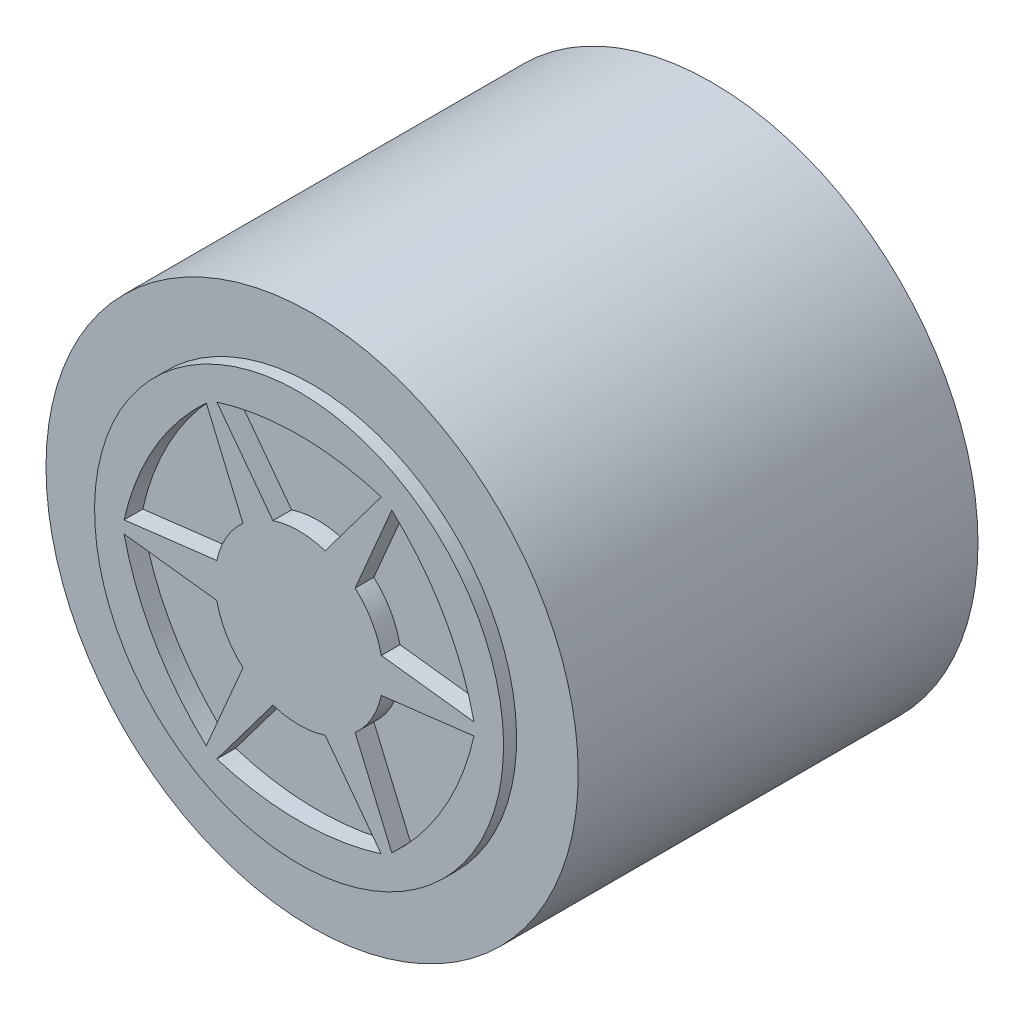
from build123d import *

# Parameters (mm, degrees)
CORTAR_EXTRUIR4_DEPTH      = 1
CROQUIS7_R                 = 7.5
CORTAR_EXTRUIR5_DEPTH      = 9
CORTAR_EXTRUIR6_DEPTH      = 9
CORTAR_EXTRUIR8_DEPTH      = 5
CORTAR_EXTRUIR8_DEPTH_BACK = 28.93644573
CROQUIS10_R                = 3
CROQUIS11_R                = 1.5
CORTAR_EXTRUIR9_DEPTH      = 5.2


with BuildPart() as part:
    # Croquis1 → Revolución1 (revolve)
    with BuildSketch(Plane(origin=(0, 0, 0), x_dir=(0, 0, -1), z_dir=(1, 0, 0))):
        Polygon((0, 0), (9.25, 0), (9.25, 10.25), (-12.25, 10.25), (-12.25, 10.95), (-12.95, 10.95), (-12.95, 0), align=None)
    revolve(axis=Axis((0, 0, 0), (0, 0, 1)))

    # Croquis5 → Cortar-Extruir4 (cut)
    with BuildSketch(Plane.XY.offset(12.95)):
        with BuildLine():
            ThreePointArc((-1.4, 4.276680956), (0, 4.5), (1.4, 4.276680956))
            Line((1.4, 4.276680956), (4.4, 8.276680956))
            ThreePointArc((4.4, 8.276680956), (0, 8.95), (-4.4, 8.276680956))
            Line((-4.4, 8.276680956), (-1.4, 4.276680956))
        make_face()
        with BuildLine():
            Line((4.967815967, 7.948852255), (3.003714352, 3.350776043))
            ThreePointArc((3.003714352, 3.350776043), (3.897114317, 2.25), (4.403714352, 0.925904913))
            Line((4.403714352, 0.925904913), (9.367815967, 0.327828701))
            ThreePointArc((9.367815967, 0.327828701), (7.750927364, 4.475), (4.967815967, 7.948852255))
        make_face()
        with BuildLine():
            Line((9.367815967, -0.327828701), (4.403714352, -0.925904913))
            ThreePointArc((4.403714352, -0.925904913), (3.897114317, -2.25), (3.003714352, -3.350776043))
            Line((3.003714352, -3.350776043), (4.967815967, -7.948852255))
            ThreePointArc((4.967815967, -7.948852255), (7.750927364, -4.475), (9.367815967, -0.327828701))
        make_face()
        with BuildLine():
            Line((4.4, -8.276680956), (1.4, -4.276680956))
            ThreePointArc((1.4, -4.276680956), (0, -4.5), (-1.4, -4.276680956))
            Line((-1.4, -4.276680956), (-4.4, -8.276680956))
            ThreePointArc((-4.4, -8.276680956), (0, -8.95), (4.4, -8.276680956))
        make_face()
        with BuildLine():
            ThreePointArc((-3.003714352, -3.350776043), (-3.897114317, -2.25), (-4.403714352, -0.925904913))
            Line((-4.403714352, -0.925904913), (-9.367815967, -0.327828701))
            ThreePointArc((-9.367815967, -0.327828701), (-7.750927364, -4.475), (-4.967815967, -7.948852255))
            Line((-4.967815967, -7.948852255), (-3.003714352, -3.350776043))
        make_face()
        with BuildLine():
            ThreePointArc((-4.403714352, 0.925904913), (-3.897114317, 2.25), (-3.003714352, 3.350776043))
            Line((-3.003714352, 3.350776043), (-4.967815967, 7.948852255))
            ThreePointArc((-4.967815967, 7.948852255), (-7.750927364, 4.475), (-9.367815967, 0.327828701))
            Line((-9.367815967, 0.327828701), (-4.403714352, 0.925904913))
        make_face()
    extrude(amount=-CORTAR_EXTRUIR4_DEPTH, mode=Mode.SUBTRACT)

    # Croquis7 → Cortar-Extruir5 (cut)
    with BuildSketch(Plane(origin=(0, 0, -9.25), x_dir=(-1, 0, 0), z_dir=(0, 0, -1))):
        with Locations(Location((0, 0, 0), (0, 0, 90))):
            Circle(CROQUIS7_R)
    extrude(amount=-CORTAR_EXTRUIR5_DEPTH, mode=Mode.SUBTRACT)

    # Croquis8 → Cortar-Extruir6 (cut)
    with BuildSketch(Plane(origin=(0, 0, -0.25), x_dir=(-1, 0, 0), z_dir=(0, 0, -1))):
        with BuildLine():
            Line((-1.140175425, -1.05), (1.140175425, -1.05))
            ThreePointArc((1.140175425, -1.05), (0, 1.55), (-1.140175425, -1.05))
        make_face()
    extrude(amount=-CORTAR_EXTRUIR6_DEPTH, mode=Mode.SUBTRACT)

    # Croquis10 → Cortar-Extruir8 (cut, two sides: drawn at the far end of the back side and taken through both)
    with BuildSketch(Plane(origin=(0, -11.25, 0), x_dir=(1, 0, 0), z_dir=(0, 1, 0)).offset(-CORTAR_EXTRUIR8_DEPTH_BACK)):
        with Locations(Location((0, -5.75, 0), (0, 0, 90))):
            Circle(CROQUIS10_R)
    extrude(amount=CORTAR_EXTRUIR8_DEPTH + CORTAR_EXTRUIR8_DEPTH_BACK, mode=Mode.SUBTRACT)

    # Croquis11 → Cortar-Extruir9 (cut)
    with BuildSketch(Plane.XZ.offset(6.25)):
        with Locations(Location((0, 5.75, 0), (0, 0, 270))):
            Circle(CROQUIS11_R)
    extrude(amount=-CORTAR_EXTRUIR9_DEPTH, mode=Mode.SUBTRACT)

    # Croquis12 → Revolución3 (revolve)
    with BuildSketch(Plane(origin=(0, 0, 0), x_dir=(0, 0, -1), z_dir=(1, 0, 0)), mode=Mode.PRIVATE) as revoluci_n3_sk:
        Polygon((-12.25, 10.25), (-12.25, 14.25), (9.156518587, 14.25), (9.25, 10.25), align=None)
    revolve(revoluci_n3_sk.sketch.rotate(Axis((0, 0, 0), (0, 0, -1)), 90), axis=Axis((0, 0, 0), (0, 0, -1)))


solid = part.part
